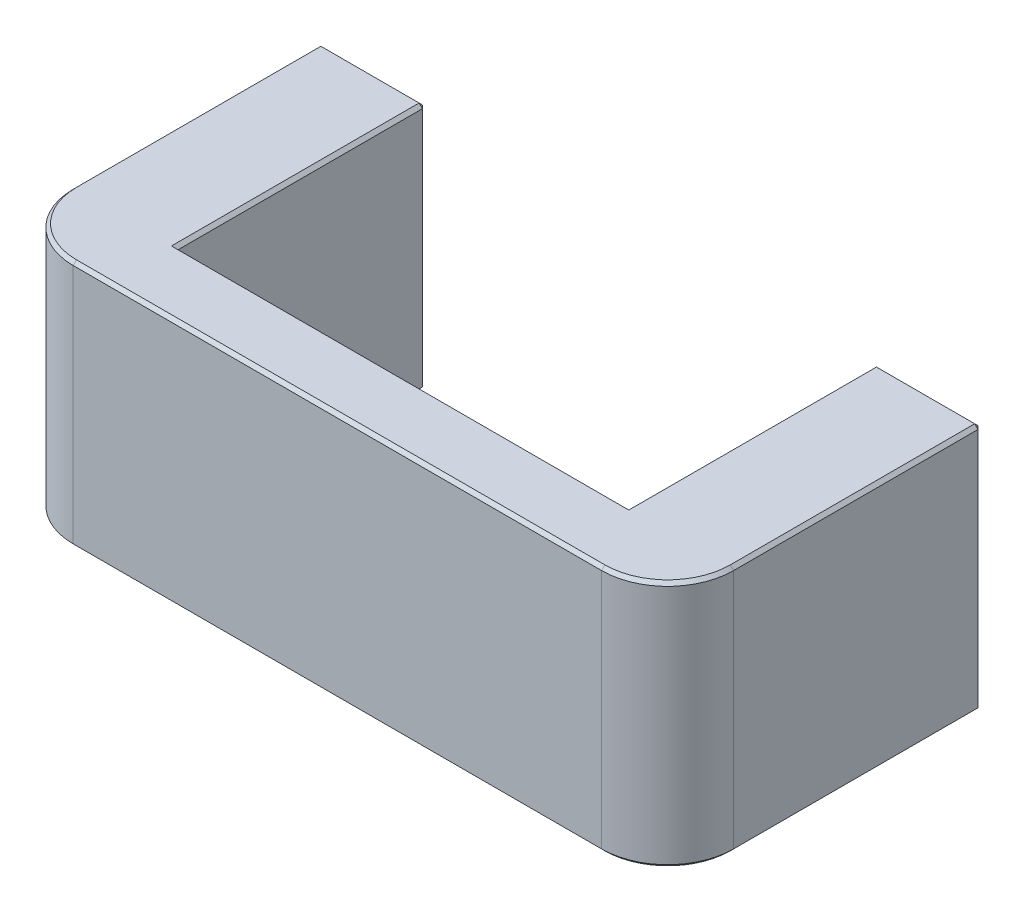
from build123d import *

# Parameters (mm, degrees)
BOSS_EXTRUDE1_DEPTH             = 30
F_2_5MM_DOWEL_HOLE1_D           = 4.8
F_2_5MM_DOWEL_HOLE1_DEPTH       = 20
F_2_5MM_DOWEL_HOLE1_CSINK_D     = 5.8
F_2_5MM_DOWEL_HOLE1_CSINK_ANGLE = 90
F_2_5MM_DOWEL_HOLE1_TIP         = 1.442065486
FILLET1_R                       = 8
CHAMFER1_SIZE                   = 0.4


with BuildPart() as part:
    # Sketch1 → Boss-Extrude1 (new body)
    with BuildSketch(Plane(origin=(0, 0, 0), x_dir=(1, 0, 0), z_dir=(0, 1, 0))):
        Polygon((-40, 30), (-40, -8), (40, -8), (40, 30), (27.3, 30), (27.3, 0), (-27.3, 0), (-27.3, 30), align=None)
    extrude(amount=BOSS_EXTRUDE1_DEPTH)

    # Ø2.5mm Dowel Hole1
    with Locations(Plane(origin=(0, 0, -30), x_dir=(-1, 0, 0), z_dir=(0, 0, -1))):
        with Locations((33.65, 7.5), (-33.65, 22.5), (-33.65, 7.5), (33.65, 22.5)):
            CounterSinkHole(F_2_5MM_DOWEL_HOLE1_D / 2, F_2_5MM_DOWEL_HOLE1_CSINK_D / 2, depth=F_2_5MM_DOWEL_HOLE1_DEPTH, counter_sink_angle=F_2_5MM_DOWEL_HOLE1_CSINK_ANGLE)
            with Locations((0, 0, -(F_2_5MM_DOWEL_HOLE1_DEPTH + F_2_5MM_DOWEL_HOLE1_TIP / 2))):  # 118° drill point
                Cone(0, F_2_5MM_DOWEL_HOLE1_D / 2, F_2_5MM_DOWEL_HOLE1_TIP, mode=Mode.SUBTRACT)

    # Fillet1
    fillet1_edges = [part.edges().sort_by_distance(p)[0] for p in [
        (-40, 15, 8),
        (40, 15, 8),
    ]]
    fillet(fillet1_edges, radius=FILLET1_R)

    # Chamfer1
    chamfer1_edges = [part.edges().sort_by_distance(p)[0] for p in [
        (-33.65, 30, -30),
        (-27.3, 30, -15),
        (0, 30, 0),
        (27.3, 30, -15),
        (33.65, 30, -30),
        (40, 30, -15),
        (37.656854249, 30, 5.656854249),
        (0, 30, 8),
        (-37.656854249, 30, 5.656854249),
        (-40, 30, -15),
        (37.656854249, 0, 5.656854249),
        (40, 0, -15),
        (40, 15, -30),
        (33.65, 0, -30),
        (0, 0, 8),
        (-37.656854249, 0, 5.656854249),
        (-40, 0, -15),
        (-40, 15, -30),
        (-33.65, 0, -30),
        (-27.3, 15, -30),
        (-27.3, 0, -15),
        (0, 0, 0),
        (27.3, 0, -15),
        (27.3, 15, -30),
    ]]
    chamfer(chamfer1_edges, length=CHAMFER1_SIZE)


solid = part.part
